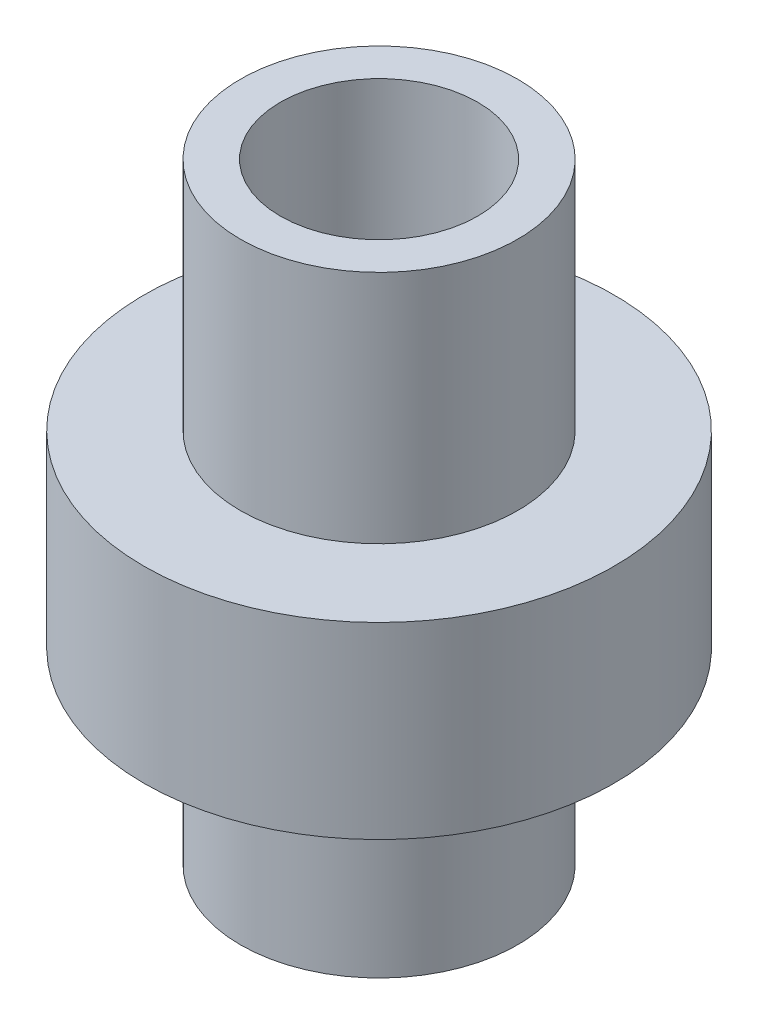
from build123d import *

# Parameters (mm, degrees)
SKETCH1_R           = 1.475
SKETCH1_R_2         = 1.05
BOSS_EXTRUDE1_DEPTH = 2
SKETCH2_R           = 2.5
SKETCH2_R_2         = 1.05
BOSS_EXTRUDE2_DEPTH = 2
SKETCH4_R           = 1.475
SKETCH4_R_2         = 1.05
BOSS_EXTRUDE3_DEPTH = 2.5


with BuildPart() as part:
    # Sketch1 → Boss-Extrude1 (new body)
    with BuildSketch(Plane(origin=(0, 0, 0), x_dir=(1, 0, 0), z_dir=(0, 1, 0))):
        Circle(SKETCH1_R)
        Circle(SKETCH1_R_2, mode=Mode.SUBTRACT)
    extrude(amount=BOSS_EXTRUDE1_DEPTH)

    # Sketch2 → Boss-Extrude2 (add)
    with BuildSketch(Plane(origin=(0, 2, 0), x_dir=(1, 0, 0), z_dir=(0, 1, 0))):
        Circle(SKETCH2_R)
        Circle(SKETCH2_R_2, mode=Mode.SUBTRACT)
    extrude(amount=BOSS_EXTRUDE2_DEPTH)

    # Sketch4 → Boss-Extrude3 (add)
    with BuildSketch(Plane(origin=(0, 4, 0), x_dir=(1, 0, 0), z_dir=(0, 1, 0))):
        Circle(SKETCH4_R)
        Circle(SKETCH4_R_2, mode=Mode.SUBTRACT)
    extrude(amount=BOSS_EXTRUDE3_DEPTH)


solid = part.part
